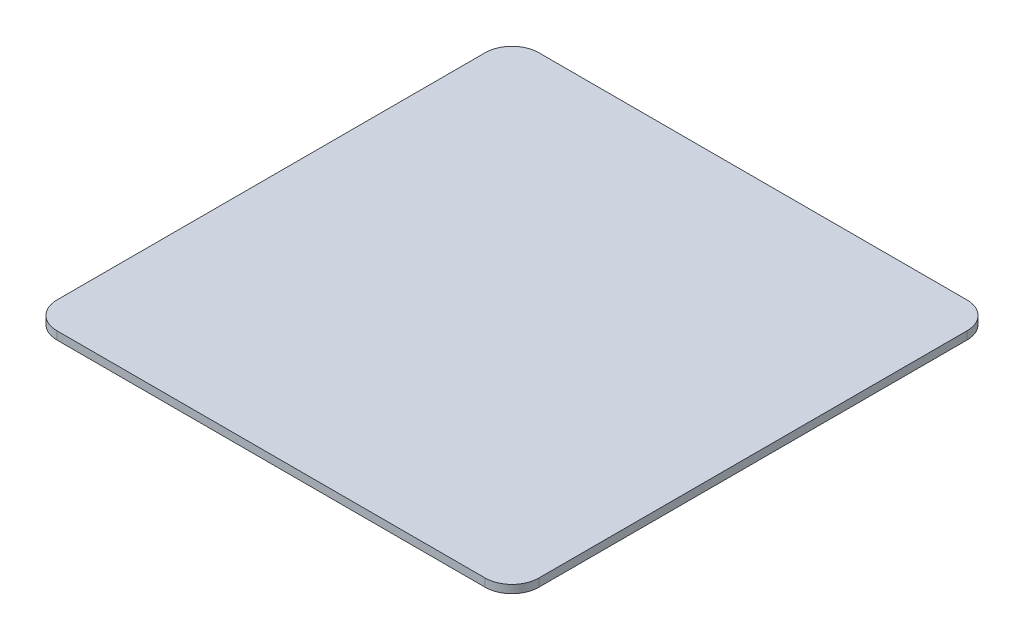
from build123d import *

# Parameters (mm, degrees)
SKETCH1_W           = 180
SKETCH1_H           = 180
BOSS_EXTRUDE1_DEPTH = 3
FILLET1_R           = 10


with BuildPart() as part:
    # Sketch1 → Boss-Extrude1 (new body)
    with BuildSketch(Plane(origin=(0, 0, 0), x_dir=(1, 0, 0), z_dir=(0, 1, 0))):
        Rectangle(SKETCH1_W, SKETCH1_H)
    extrude(amount=BOSS_EXTRUDE1_DEPTH)

    # Fillet1
    fillet1_edges = [part.edges().sort_by_distance(p)[0] for p in [
        (90, 1.5, 90),
        (-90, 1.5, 90),
        (-90, 1.5, -90),
        (90, 1.5, -90),
    ]]
    fillet(fillet1_edges, radius=FILLET1_R)


solid = part.part
